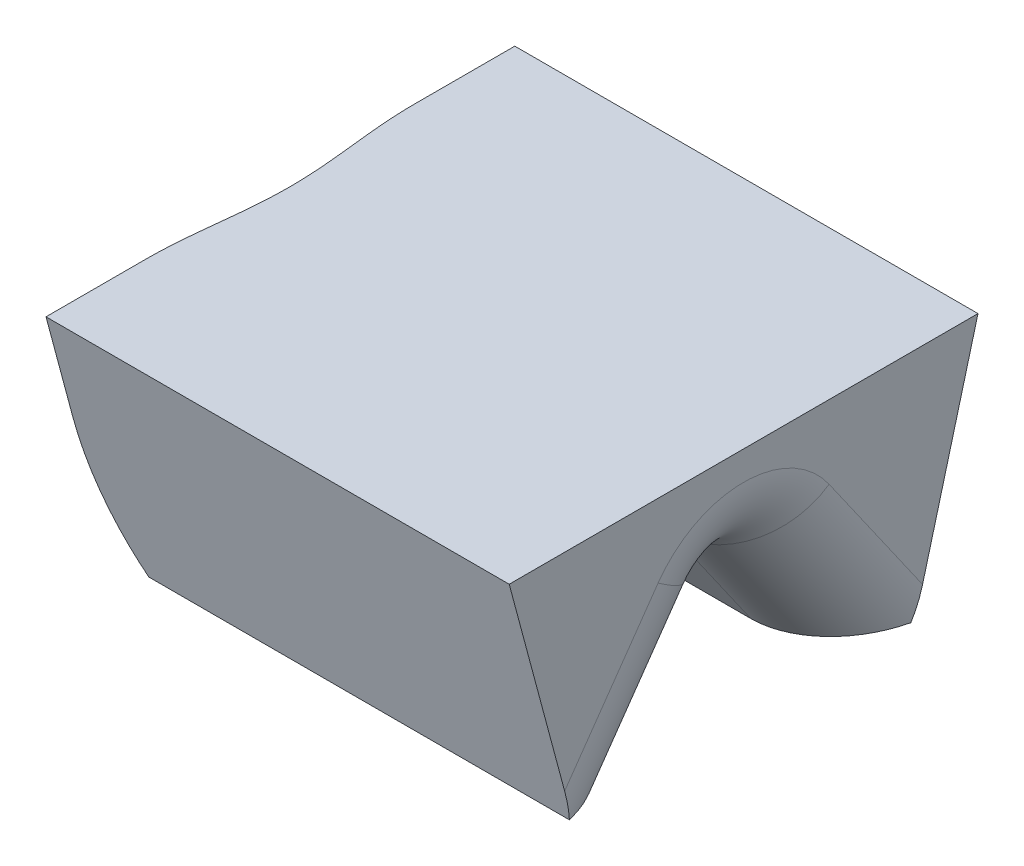
from build123d import *

# Parameters (mm, degrees)
SKETCH_TL_CUTTING_R    = 1.4986
TL_CUTTING_DEPTH       = 75.9968
SKETCH_TDF_CUTTING_W   = 3.01719996
SKETCH_TDF_CUTTING_H   = 3.01719996
TDF_CUTTING_DEPTH      = 77.026345527
VW_VR_GRINDING_DEPTH   = 1.50859998
VW_VR_GRINDING_2_DEPTH = 1.50859998
ISA_GRINDING_DEPTH     = 1.50859998
SKETCH_PRE_FRX_BRX_W   = 1.21682002
SKETCH_PRE_FRX_BRX_H   = 0.83312
SKETCH_PRE_FRX_BRX_W_2 = 1.24935996
PRE_FRX_BRX_DEPTH      = 1.50859998
FA_BA_GRINDING_DEPTH   = 1.50859998
BR_EDM_R               = 0.20066
FR_EDM_R               = 0.1016
SKETCH_ENGRAVING_W     = 0.033186299
SKETCH_ENGRAVING_H     = 1.128593452
SKETCH_ENGRAVING_H_2   = 1.128593453
ENGRAVING_DEPTH        = 0.005


with BuildPart() as part:
    # sketch_TL_cutting → TL_cutting (new body)
    with BuildSketch(Plane(origin=(0, 0, 0), x_dir=(1, 0, 0), z_dir=(0, 1, 0))):
        with Locations(Location((0, 0, 0), (0, 0, 270))):
            Circle(SKETCH_TL_CUTTING_R)
    extrude(amount=TL_CUTTING_DEPTH)

    # sketch_TDF_cutting → TDF_cutting (cut, through all)
    with BuildSketch(Plane(origin=(0, 0, 0), x_dir=(1, 0, 0), z_dir=(0, 1, 0))):
        with Locations((-2.71001998, 0)):
            Rectangle(SKETCH_TDF_CUTTING_W, SKETCH_TDF_CUTTING_H)
    extrude(amount=TDF_CUTTING_DEPTH, mode=Mode.SUBTRACT)


with BuildPart() as body_2:
    # sketch_VW_VR_grinding → VW_VR_grinding (new, symmetric)
    with BuildSketch(Plane(origin=(0, 0, 0), x_dir=(0, 0, -1), z_dir=(1, 0, 0))):
        with BuildLine():
            Line((-1.49360001, -0.00999998), (-1.49360001, 0.822008914))
            ThreePointArc((-1.49360001, 0.822008914), (-1.493648337, 0.823115792), (-1.493792952, 0.824214246))
            Line((-1.493792952, 0.824214246), (-1.51859996, 0.964901782))
            Line((-1.51859996, 0.964901782), (-1.50859998, -0.00999998))
            Line((-1.50859998, -0.00999998), (-1.49360001, -0.00999998))
        make_face()
    extrude(amount=VW_VR_GRINDING_DEPTH, both=True)


with BuildPart() as body_3:
    # sketch_VW_VR_grinding → VW_VR_grinding 2 (new, symmetric)
    with BuildSketch(Plane(origin=(0, 0, 0), x_dir=(0, 0, -1), z_dir=(1, 0, 0))):
        with BuildLine():
            Line((1.49360001, -0.00999998), (1.49360001, 0.822008914))
            ThreePointArc((1.49360001, 0.822008914), (1.493648337, 0.823115792), (1.493792952, 0.824214246))
            Line((1.493792952, 0.824214246), (1.51859996, 0.964901782))
            Line((1.51859996, 0.964901782), (1.50859998, -0.00999998))
            Line((1.50859998, -0.00999998), (1.49360001, -0.00999998))
        make_face()
    extrude(amount=VW_VR_GRINDING_2_DEPTH, both=True)


    add(body_2.part)  # ISA_grinding merges body 2
    # sketch_ISA_grinding → ISA_grinding (add, symmetric)
    with BuildSketch(Plane(origin=(0, 0, 0), x_dir=(0, 0, -1), z_dir=(1, 0, 0))):
        Polygon((-0.19939, 0), (0.19939, 0), (1.50859998, 4.886038163), (1.50859998, -0.02999994), (-1.50859998, -0.02999994), (-1.50859998, 4.886038163), align=None)
    extrude(amount=ISA_GRINDING_DEPTH, both=True)

    # sketch_pre_FRX_BRX → pre_FRX_BRX (add, symmetric)
    with BuildSketch(Plane.XY):
        with Locations((0.89018999, 0.40656002)):
            Rectangle(SKETCH_PRE_FRX_BRX_W, SKETCH_PRE_FRX_BRX_H)
        with Locations((-0.89391998, 0.40656002)):
            Rectangle(SKETCH_PRE_FRX_BRX_W_2, SKETCH_PRE_FRX_BRX_H)
    extrude(amount=PRE_FRX_BRX_DEPTH, both=True)

    # sketch_FA_BA_grinding → FA_BA_grinding (add, symmetric)
    with BuildSketch(Plane.XY):
        Polygon((0.27178, -0.00999998), (0.27178, 0.83312), (1.6256, 10.466049838), (1.6256, -0.00999998), align=None)
        Polygon((-0.26924, -0.00999998), (-0.26924, 0.83312), (-1.32842, 8.369577303), (-1.32842, -0.00999998), align=None)
    extrude(amount=FA_BA_GRINDING_DEPTH, both=True)


with BuildPart() as part_1:
    add(part.part)

    # B1_fix: cut body 3
    add(body_3.part, mode=Mode.SUBTRACT)

    # V-Groove_EDM: sweep along a path in sketch_contour_V-Groove
    with BuildLine(Plane.XY) as v_groove_edm_path:
        Line((-1.20142, 0.14224), (1.4986, 0.14224))
    # sketch_section_V-Groove → V-Groove_EDM (sweep, cut)
    with BuildSketch(Plane(origin=(-1.20142, 0, -1.2954), x_dir=(0, 0, -1), z_dir=(1, 0, 0))):
        with BuildLine():
            Line((-1.27875483, 0.133575073), (-1.178222496, -0.00999998))
            Line((-1.178222496, -0.00999998), (-1.412577504, -0.00999998))
            Line((-1.412577504, -0.00999998), (-1.31204517, 0.133575073))
            ThreePointArc((-1.31204517, 0.133575073), (-1.2954, 0.14224), (-1.27875483, 0.133575073))
        make_face()
    sweep(path=v_groove_edm_path.line, mode=Mode.SUBTRACT)

    # BR_EDM
    br_edm_edges = [part_1.edges().sort_by_distance(p)[0] for p in [
        (-0.26924, 0.14224, 0),
        (-0.26924, 0.066787537, -0.063410306),
        (-0.26924, 0.066787537, 0.063410306),
    ]]
    fillet(br_edm_edges, radius=BR_EDM_R)

    # FR_EDM
    fr_edm_edges = [part_1.edges().sort_by_distance(p)[0] for p in [
        (0.27178, 0.066787537, -0.063410306),
        (0.27178, 0.066787537, 0.063410306),
        (0.27178, 0.14224, 0),
    ]]
    fillet(fr_edm_edges, radius=FR_EDM_R)

    # sketch_Engraving → Engraving (cut)
    # profile 1 of 14: a face of its own
    with BuildSketch(Plane.ZY.offset(1.20142)):
        Polygon((0.531688452, 45.269846756), (0.531688452, 44.551415224), (0.030264207, 44.92787231), (0.030264207, 44.765052028), (-0.034552784, 44.633862437), (-0.102740259, 44.56723057), (-0.296154161, 44.503450651), (-0.425528876, 44.503450651), (-0.618942778, 44.56723057), (-0.749354564, 44.69842016), (-0.81235668, 44.891834063), (-0.81235668, 45.083433089), (-0.749354564, 45.276846991), (-0.682722697, 45.345293734), (-0.555940662, 45.408295849), (-0.541940192, 45.382887589), (-0.665351744, 45.320663277), (-0.724724108, 45.262846521), (-0.785133544, 45.080062605), (-0.785133544, 44.895463814), (-0.724724108, 44.712420631), (-0.604164504, 44.592638831), (-0.42112132, 44.531451591), (-0.299524645, 44.531451591), (-0.116740729, 44.592638831), (-0.059701777, 44.652270463), (0.001485463, 44.772052263), (0.001485463, 44.985429798), (0.502909708, 44.60923198), (0.502909708, 45.269846756), align=None)
    # profile 2 of 14: a face of its own
    with BuildSketch(Plane.ZY.offset(1.20142)):
        Polygon((-0.79576353, 43.729743189), (-0.79576353, 43.758521933), (0.483723879, 43.758521933), (0.316755309, 43.923157091), (0.254530997, 44.049939126), (0.278902186, 44.064976668), (0.341904302, 43.940528044), (0.531688452, 43.74996609), (0.531688452, 43.729743189), align=None)
    # profile 3 of 14: a face of its own
    with BuildSketch(Plane.ZY.offset(1.20142)):
        Polygon((-0.79576353, 42.579837909), (-0.79576353, 42.608616653), (0.483723879, 42.608616653), (0.316755309, 42.773251811), (0.254530997, 42.900033846), (0.278902186, 42.915071388), (0.341904302, 42.790622765), (0.531688452, 42.60006081), (0.531688452, 42.579837909), align=None)
    # profile 4 of 14: a face of its own
    with BuildSketch(Plane.ZY.offset(1.20142)):
        Polygon((-0.786170615, 41.055549687), (-0.79576353, 41.079920876), (-0.367193584, 41.245333838), (-0.367193584, 41.893763019), (-0.79576353, 42.059175981), (-0.786170615, 42.08354717), (0.531688452, 41.578752441), (0.531688452, 41.559566612), align=None)
        Polygon((-0.340748251, 41.255704557), (0.478538519, 41.569159527), (-0.340748251, 41.883133033), align=None, mode=Mode.SUBTRACT)
    # profile 5 of 14: a face of its own
    with BuildSketch(Plane.ZY.offset(1.20142)):
        with Locations((-0.231596438, 40.285083075)):
            Rectangle(SKETCH_ENGRAVING_W, SKETCH_ENGRAVING_H)
    # profile 6 of 14: a face of its own
    with BuildSketch(Plane.ZY.offset(1.20142)):
        Polygon((0.515095302, 38.490248732), (-0.79576353, 38.988821029), (-0.79576353, 39.018636845), (0.521058466, 39.518246214), (0.531688452, 39.493875025), (-0.756354799, 39.003858571), (0.525466021, 38.514619921), align=None)
    # profile 7 of 14: a face of its own
    with BuildSketch(Plane.ZY.offset(1.20142)):
        Polygon((-0.786170615, 38.108295165), (0.502909708, 37.49227448), (0.502909708, 38.347080961), (0.531688452, 38.347080961), (0.531688452, 37.44508771), (-0.79576353, 38.083664709), align=None)
    # profile 8 of 14: a face of its own
    with BuildSketch(Plane.ZY.offset(1.20142)):
        Polygon((-0.554125786, 36.366740389), (-0.749354564, 36.498189247), (-0.81235668, 36.693158757), (-0.81235668, 36.82279274), (-0.749354564, 37.01776225), (-0.554125786, 37.148174036), (-0.237559601, 37.211176152), (-0.044923503, 37.211176152), (0.271901951, 37.148174036), (0.466871461, 37.01776225), (0.531688452, 36.82279274), (0.531688452, 36.693158757), (0.466871461, 36.498189247), (0.271901951, 36.366740389), (-0.044923503, 36.304775345), (-0.237559601, 36.304775345), align=None)
        Polygon((-0.539347512, 36.395778401), (-0.22874449, 36.332776285), (-0.044923503, 36.332776285), (0.26567952, 36.395778401), (0.446907827, 36.515560201), (0.507057995, 36.696788509), (0.507057995, 36.818385184), (0.446907827, 36.999613492), (0.26567952, 37.120173096), (-0.044923503, 37.182397408), (-0.22874449, 37.182397408), (-0.539347512, 37.120173096), (-0.72057582, 36.999613492), (-0.780985256, 36.818385184), (-0.780985256, 36.696788509), (-0.72057582, 36.515560201), align=None, mode=Mode.SUBTRACT)
    # profile 9 of 14: a face of its own
    with BuildSketch(Plane.ZY.offset(1.20142)):
        with Locations((-0.231596438, 35.419971561)):
            Rectangle(SKETCH_ENGRAVING_W, SKETCH_ENGRAVING_H_2)
    # profile 10 of 14: a face of its own
    with BuildSketch(Plane.ZY.offset(1.20142)):
        Polygon((-0.541940192, 34.502759279), (-0.665351744, 34.440534968), (-0.724724108, 34.382718211), (-0.785133544, 34.199934296), (-0.785133544, 34.015335505), (-0.724724108, 33.832292321), (-0.604164504, 33.712510521), (-0.42112132, 33.651323281), (-0.299524645, 33.651323281), (-0.116740729, 33.712510521), (0.003041071, 33.832292321), (0.064487579, 34.015335505), (0.064487579, 34.199934296), (0.003041071, 34.382718211), (-0.086924913, 34.470350784), (0.531688452, 34.402941113), (0.531688452, 33.762289971), (0.502909708, 33.762289971), (0.502909708, 34.377532852), (-0.007329648, 34.434312537), (0.028449332, 34.396718682), (0.092488519, 34.203304779), (0.092488519, 34.011705753), (0.028449332, 33.818291851), (-0.102740259, 33.687102261), (-0.296154161, 33.623322341), (-0.425528876, 33.623322341), (-0.618942778, 33.687102261), (-0.749354564, 33.818291851), (-0.81235668, 34.011705753), (-0.81235668, 34.203304779), (-0.749354564, 34.396718682), (-0.682722697, 34.465165424), (-0.555940662, 34.52816754), align=None)
    # profile 11 of 14: a face of its own
    with BuildSketch(Plane.ZY.offset(1.20142)):
        Polygon((-0.554125786, 32.535382105), (-0.749354564, 32.666830964), (-0.81235668, 32.861800473), (-0.81235668, 32.991434456), (-0.749354564, 33.186403966), (-0.554125786, 33.316815753), (-0.237559601, 33.379817868), (-0.044923503, 33.379817868), (0.271901951, 33.316815753), (0.466871461, 33.186403966), (0.531688452, 32.991434456), (0.531688452, 32.861800473), (0.466871461, 32.666830964), (0.271901951, 32.535382105), (-0.044923503, 32.473417061), (-0.237559601, 32.473417061), align=None)
        Polygon((-0.539347512, 32.564420117), (-0.22874449, 32.501418002), (-0.044923503, 32.501418002), (0.26567952, 32.564420117), (0.446907827, 32.684201917), (0.507057995, 32.865430225), (0.507057995, 32.987026901), (0.446907827, 33.168255208), (0.26567952, 33.288814812), (-0.044923503, 33.351039124), (-0.22874449, 33.351039124), (-0.539347512, 33.288814812), (-0.72057582, 33.168255208), (-0.780985256, 32.987026901), (-0.780985256, 32.865430225), (-0.72057582, 32.684201917), align=None, mode=Mode.SUBTRACT)
    # profile 12 of 14: a face of its own
    with BuildSketch(Plane.ZY.offset(1.20142)):
        Polygon((-0.554125786, 31.385476826), (-0.749354564, 31.516925684), (-0.81235668, 31.711895194), (-0.81235668, 31.841529177), (-0.749354564, 32.036498686), (-0.554125786, 32.166910473), (-0.237559601, 32.229912589), (-0.044923503, 32.229912589), (0.271901951, 32.166910473), (0.466871461, 32.036498686), (0.531688452, 31.841529177), (0.531688452, 31.711895194), (0.466871461, 31.516925684), (0.271901951, 31.385476826), (-0.044923503, 31.323511782), (-0.237559601, 31.323511782), align=None)
        Polygon((-0.539347512, 31.414514838), (-0.22874449, 31.351512722), (-0.044923503, 31.351512722), (0.26567952, 31.414514838), (0.446907827, 31.534296638), (0.507057995, 31.715524945), (0.507057995, 31.837121621), (0.446907827, 32.018349929), (0.26567952, 32.138909533), (-0.044923503, 32.201133844), (-0.22874449, 32.201133844), (-0.539347512, 32.138909533), (-0.72057582, 32.018349929), (-0.780985256, 31.837121621), (-0.780985256, 31.715524945), (-0.72057582, 31.534296638), align=None, mode=Mode.SUBTRACT)
    # profile 13 of 14: a face of its own
    with BuildSketch(Plane.ZY.offset(1.20142)):
        with Locations((-0.231596438, 30.438707997)):
            Rectangle(SKETCH_ENGRAVING_W, SKETCH_ENGRAVING_H_2)
    # profile 14 of 14: a face of its own
    with BuildSketch(Plane.ZY.offset(1.20142)):
        Polygon((-0.79576353, 29.018256595), (-0.79576353, 29.04703534), (0.483723879, 29.04703534), (0.316755309, 29.211670497), (0.254530997, 29.338452532), (0.278902186, 29.353490074), (0.341904302, 29.229041451), (0.531688452, 29.038479497), (0.531688452, 29.018256595), align=None)
    extrude(amount=-ENGRAVING_DEPTH, mode=Mode.SUBTRACT)

    # SurfaceCut1
    split(bisect_by=Plane(origin=(0, 0.277595628, 0), x_dir=(1, 0, 0), z_dir=(0, 1, 0)), keep=Keep.BOTTOM)


solid = part_1.part
